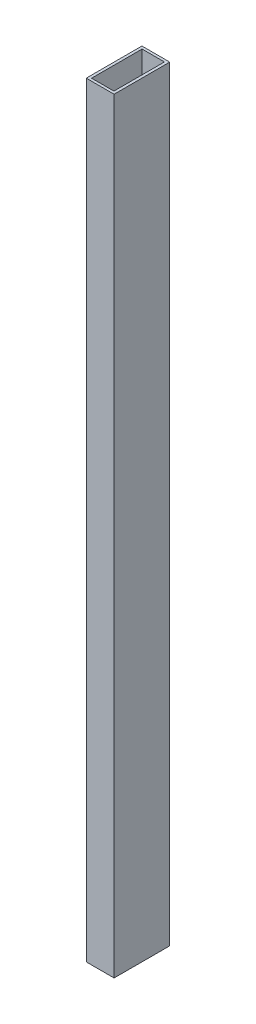
from build123d import *

# Parameters (mm, degrees)
SKETCH1_W               = 25.4
SKETCH1_H               = 50.8
BOSS_EXTRUDE1_DEPTH     = 698.5
CUT_EXTRUDE1_DEPTH      = 10
CUT_EXTRUDE1_DEPTH_BACK = 508
SKETCH5_W               = 20.420863107
SKETCH5_H               = 46.117633818


with BuildPart() as part:
    # Sketch1 → Boss-Extrude1 (new body)
    with BuildSketch(Plane(origin=(0, 0, 0), x_dir=(1, 0, 0), z_dir=(0, 1, 0))):
        with Locations((2.728536082, 0.295993891)):
            Rectangle(SKETCH1_W, SKETCH1_H)
    extrude(amount=BOSS_EXTRUDE1_DEPTH)

    # Sketch5 → Cut-Extrude1 (cut, two sides: drawn at the far end of the back side and taken through both)
    with BuildSketch(Plane(origin=(0, 698.5, 0), x_dir=(1, 0, 0), z_dir=(0, 1, 0)).offset(-CUT_EXTRUDE1_DEPTH_BACK)):
        with Locations((2.697501427, 0.327028619)):
            Rectangle(SKETCH5_W, SKETCH5_H)
    extrude(amount=CUT_EXTRUDE1_DEPTH + CUT_EXTRUDE1_DEPTH_BACK, mode=Mode.SUBTRACT)


solid = part.part
